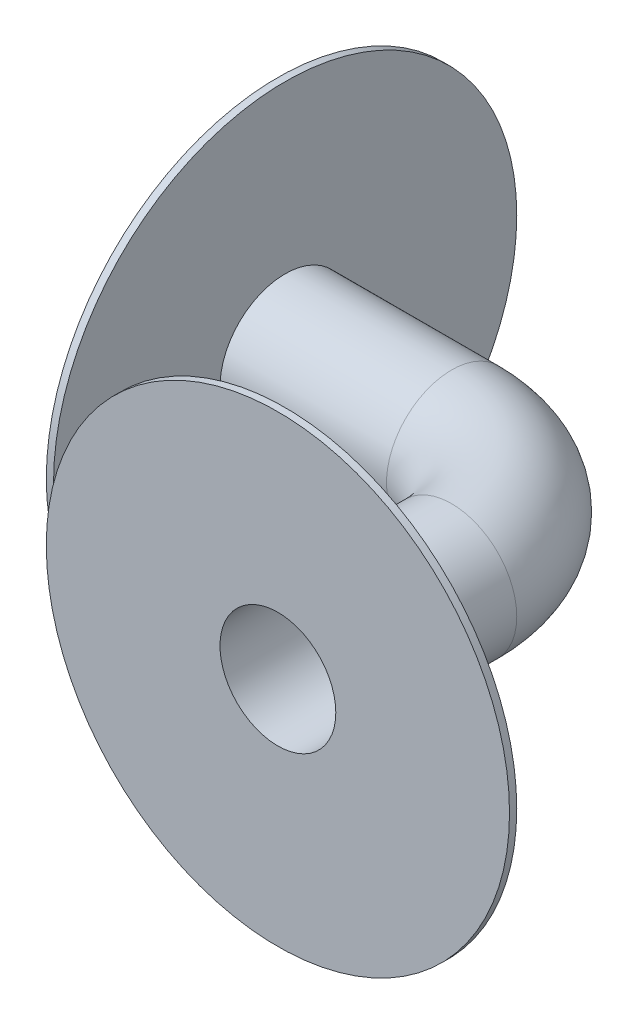
from build123d import *

# Parameters (mm, degrees)
SKETCH1_R           = 14.2875
SKETCH1_R_2         = 12.7
REVOLVE1_ANGLE      = 90
SKETCH2_R           = 14.2875
SKETCH2_R_2         = 12.7
BOSS_EXTRUDE1_DEPTH = 38.1
SKETCH3_R           = 14.2875
SKETCH3_R_2         = 12.7
BOSS_EXTRUDE2_DEPTH = 38.1
BOSS_EXTRUDE3_START = -1.5875
SKETCH4_R           = 50.8
SKETCH4_R_2         = 12.7
BOSS_EXTRUDE3_DEPTH = 1.5875
BOSS_EXTRUDE4_START = -1.5875
SKETCH5_R           = 50.8
SKETCH5_R_2         = 12.7
BOSS_EXTRUDE4_DEPTH = 1.5875


with BuildPart() as part:
    # Sketch1 → Revolve1 (revolve)
    with BuildSketch(Plane(origin=(0, 0, 0), x_dir=(0, 0, -1), z_dir=(1, 0, 0))):
        Circle(SKETCH1_R)
        Circle(SKETCH1_R_2, mode=Mode.SUBTRACT)
    revolve(axis=Axis((0, 0, 25.4), (0, -1, 0)), revolution_arc=REVOLVE1_ANGLE)

    # Sketch2 → Boss-Extrude1 (add)
    with BuildSketch(Plane.XY.offset(25.4)):
        with Locations((25.4, 0)):
            Circle(SKETCH2_R)
        with Locations((25.4, 0)):
            Circle(SKETCH2_R_2, mode=Mode.SUBTRACT)
    extrude(amount=BOSS_EXTRUDE1_DEPTH)

    # Sketch3 → Boss-Extrude2 (add)
    with BuildSketch(Plane.ZY):
        with Locations(Location((0, 0, 0), (0, 0, 180))):
            Circle(SKETCH3_R)
        with Locations(Location((0, 0, 0), (0, 0, 180))):
            Circle(SKETCH3_R_2, mode=Mode.SUBTRACT)
    extrude(amount=BOSS_EXTRUDE2_DEPTH)

    # Sketch4 → Boss-Extrude3 (add)
    with BuildSketch(Plane.ZY.offset(38.1).offset(BOSS_EXTRUDE3_START)):
        Circle(SKETCH4_R)
        with Locations(Location((0, 0, 0), (0, 0, 180))):
            Circle(SKETCH4_R_2, mode=Mode.SUBTRACT)
    extrude(amount=BOSS_EXTRUDE3_DEPTH)

    # Sketch5 → Boss-Extrude4 (add)
    with BuildSketch(Plane.XY.offset(63.5).offset(BOSS_EXTRUDE4_START)):
        with Locations((25.4, 0)):
            Circle(SKETCH5_R)
        with Locations((25.4, 0)):
            Circle(SKETCH5_R_2, mode=Mode.SUBTRACT)
    extrude(amount=BOSS_EXTRUDE4_DEPTH)


solid = part.part
